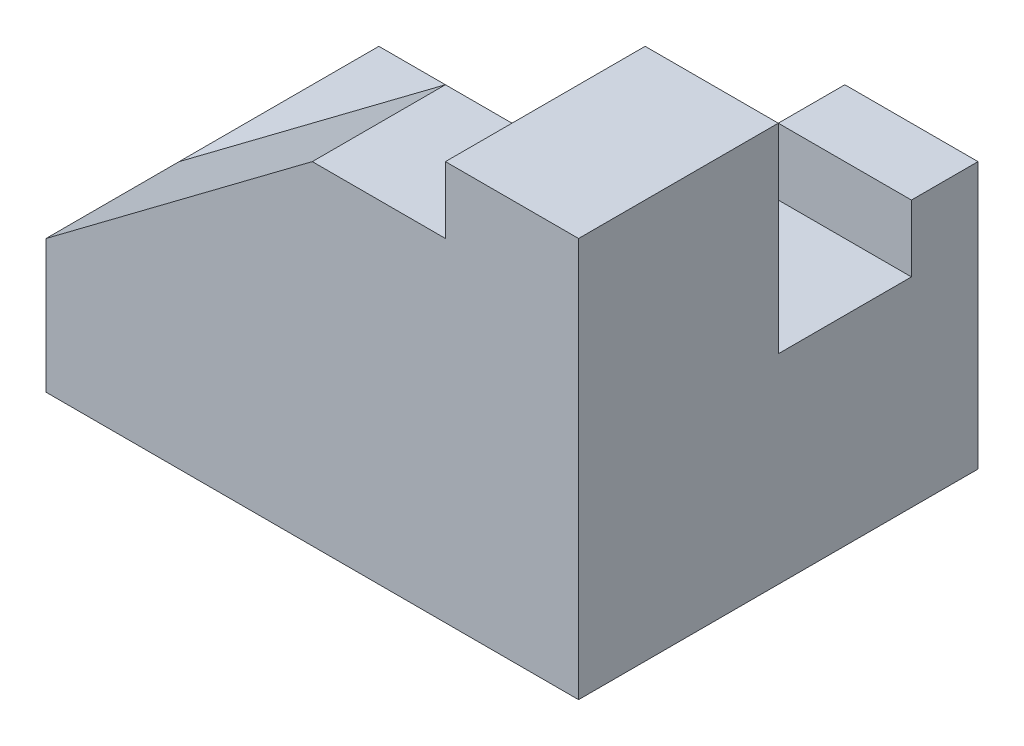
from build123d import *

# Parameters (mm, degrees)
SALIENTE_EXTRUIR1_DEPTH = 200
CROQUIS3_W              = 600
CROQUIS3_H              = 200
SALIENTE_EXTRUIR2_DEPTH = 600
CORTAR_EXTRUIR1_REACH   = 783.025
CROQUIS4_W              = 600
CROQUIS4_H              = 100
CORTAR_EXTRUIR2_REACH   = 783.025
CROQUIS6_W              = 600
CROQUIS6_H              = 200
SALIENTE_EXTRUIR3_DEPTH = 300
CORTAR_EXTRUIR3_DEPTH   = 200


with BuildPart() as part:
    # Croquis2 → Saliente-Extruir1 (new body)
    with BuildSketch(Plane(origin=(0, 0, 0), x_dir=(0, 0, -1), z_dir=(1, 0, 0))):
        Polygon((-300, -300), (300, -300), (300, 0), (300, 100), (200, 100), (200, 0), (0, 0), (0, 300), (-300, 300), align=None)
    extrude(amount=SALIENTE_EXTRUIR1_DEPTH)

    # Croquis3 → Saliente-Extruir2 (add)
    with BuildSketch(Plane.ZY):
        with Locations((0, -200)):
            Rectangle(CROQUIS3_W, CROQUIS3_H)
    extrude(amount=SALIENTE_EXTRUIR2_DEPTH)

    # Croquis4 → Cortar-Extruir1 (cut, up to next)
    with BuildSketch(Plane(origin=(0, -100, 0), x_dir=(1, 0, 0), z_dir=(0, 1, 0)), mode=Mode.PRIVATE) as cortar_extruir1_sk1:
        with Locations((-300, 250)):
            Rectangle(CROQUIS4_W, CROQUIS4_H)
    cortar_extruir1_tool1 = extrude(cortar_extruir1_sk1.sketch, amount=-CORTAR_EXTRUIR1_REACH, mode=Mode.PRIVATE) & part.part
    add(cortar_extruir1_tool1.solids().sort_by_distance((-300, -100, -250))[0], mode=Mode.SUBTRACT)

    # Croquis5 → Cortar-Extruir2 (cut, up to next)
    with BuildSketch(Plane(origin=(0, -100, 0), x_dir=(1, 0, 0), z_dir=(0, 1, 0)), mode=Mode.PRIVATE) as cortar_extruir2_sk1:
        with BuildLine():
            Line((-500, 200), (-100, 200))
            ThreePointArc((-100, 200), (-300, 0), (-500, 200))
        make_face()
    cortar_extruir2_tool1 = extrude(cortar_extruir2_sk1.sketch, amount=-CORTAR_EXTRUIR2_REACH, mode=Mode.PRIVATE) & part.part
    add(cortar_extruir2_tool1.solids().sort_by_distance((-300, -100, -115.117364))[0], mode=Mode.SUBTRACT)

    # Croquis6 → Saliente-Extruir3 (add)
    with BuildSketch(Plane(origin=(0, -100, 0), x_dir=(1, 0, 0), z_dir=(0, 1, 0))):
        with Locations((-300, -200)):
            Rectangle(CROQUIS6_W, CROQUIS6_H)
    extrude(amount=SALIENTE_EXTRUIR3_DEPTH)

    # Croquis7 → Cortar-Extruir3 (cut)
    with BuildSketch(Plane(origin=(0, 0, 100), x_dir=(-1, 0, 0), z_dir=(0, 0, -1))):
        Polygon((200, 200), (600, -100), (600, 200), align=None)
    extrude(amount=-CORTAR_EXTRUIR3_DEPTH, mode=Mode.SUBTRACT)


solid = part.part
